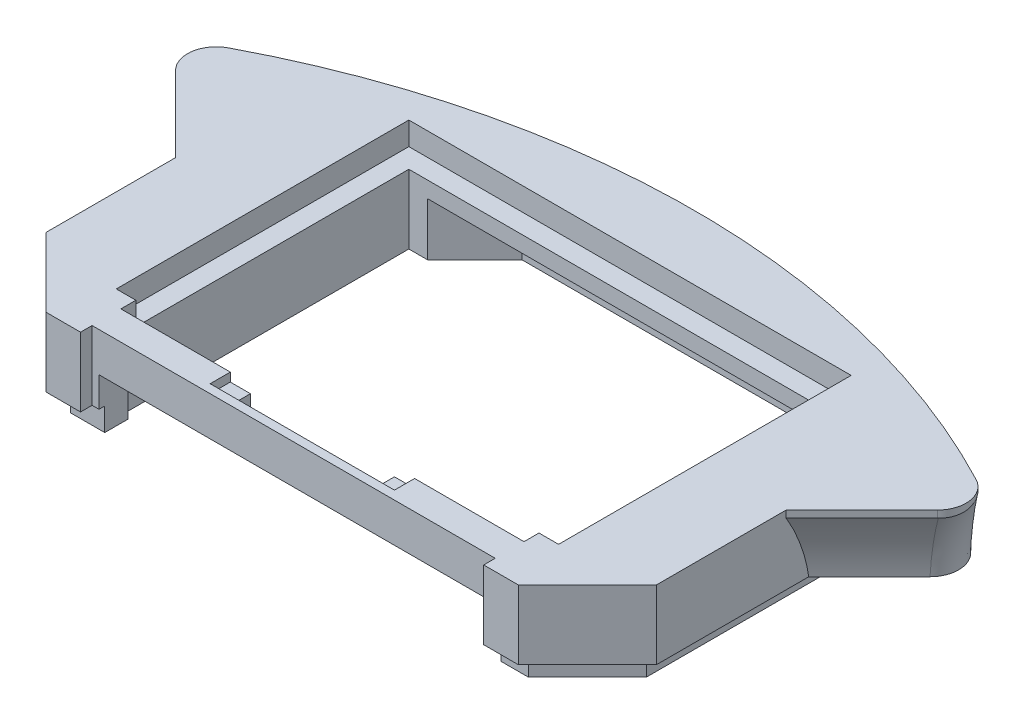
from build123d import *

# Parameters (mm, degrees)
BOSS_EXTRUDE1_DEPTH = 16
CUT_EXTRUDE1_DEPTH  = 9.2
CUT_EXTRUDE2_REACH  = 152.177
SKETCH3_W           = 70
SKETCH3_H           = 50
SKETCH7_OUTSIDE_W   = 133.782
SKETCH7_OUTSIDE_H   = 99.382
CUT_EXTRUDE5_DEPTH  = 4
BOSS_EXTRUDE3_START = -12
BOSS_EXTRUDE3_DEPTH = 12
CUT_EXTRUDE7_REACH  = 174.842
SKETCH9_R           = 38
CUT_EXTRUDE8_REACH  = 174.842
SKETCH10_R          = 38
FILLET1_R           = 5
SKETCH12_W          = 25
SKETCH12_H          = 3.5
CUT_EXTRUDE10_DEPTH = 4
SKETCH13_W          = 3.5
SKETCH13_H          = 3.5
CUT_EXTRUDE11_DEPTH = 1.5
CUT_EXTRUDE12_REACH = 157.926
SKETCH14_W          = 70
SKETCH14_H          = 2
CUT_EXTRUDE13_DEPTH = 4


with BuildPart() as part:
    # Sketch1 → Boss-Extrude1 (new body)
    with BuildSketch(Plane(origin=(0, 0, 0), x_dir=(1, 0, 0), z_dir=(0, 1, 0))):
        with BuildLine():
            Line((-53, 129.147822281), (-53, 80))
            Line((-53, 80), (-41, 68))
            Line((-41, 68), (41, 68))
            Line((41, 68), (53, 80))
            Line((53, 80), (53, 129.147822281))
            ThreePointArc((53, 129.147822281), (0, 139.6), (-53, 129.147822281))
        make_face()
    extrude(amount=BOSS_EXTRUDE1_DEPTH)

    # Sketch2 → Cut-Extrude1 (cut)
    with BuildSketch(Plane.XZ):
        Polygon((-33.8, -122.965685425), (-33.8, -62.4), (35, -62.4), (35, -122.965685425), (24.765685425, -133.2), (-23.565685425, -133.2), align=None)
    extrude(amount=-CUT_EXTRUDE1_DEPTH, mode=Mode.SUBTRACT)

    # Sketch3 → Cut-Extrude2 (cut, up to next)
    with BuildSketch(Plane(origin=(0, 16, 0), x_dir=(1, 0, 0), z_dir=(0, 1, 0)), mode=Mode.PRIVATE) as cut_extrude2_sk1:
        with Locations((0, 100)):
            Rectangle(SKETCH3_W, SKETCH3_H)
    cut_extrude2_tool1 = extrude(cut_extrude2_sk1.sketch, amount=-CUT_EXTRUDE2_REACH, mode=Mode.PRIVATE) & part.part
    add(cut_extrude2_tool1.solids().sort_by_distance((0, 16, -100))[0], mode=Mode.SUBTRACT)

    # Sketch7 outside → Cut-Extrude5 (cut)
    with BuildSketch(Plane.XZ):
        with Locations((0, -103.8)):
            Rectangle(SKETCH7_OUTSIDE_W, SKETCH7_OUTSIDE_H)
        with BuildLine():
            Line((-50, -81.242640687), (-50, -127.120258024))
            ThreePointArc((-50, -127.120258024), (0, -136.6), (50, -127.120258024))
            Line((50, -127.120258024), (50, -81.242640687))
            Line((50, -81.242640687), (39.757359313, -71))
            Line((39.757359313, -71), (35, -71))
            Line((35, -71), (-33.8, -71))
            Line((-33.8, -71), (-39.757359313, -71))
            Line((-39.757359313, -71), (-50, -81.242640687))
        make_face(mode=Mode.SUBTRACT)
    extrude(amount=-CUT_EXTRUDE5_DEPTH, mode=Mode.SUBTRACT)

    # Sketch8 → Boss-Extrude3 (add)
    with BuildSketch(Plane(origin=(0, 16, 0), x_dir=(1, 0, 0), z_dir=(0, 1, 0)).offset(BOSS_EXTRUDE3_START)):
        with BuildLine():
            Line((70.810563619, 120.308038302), (53, 102.497474683))
            Line((53, 102.497474683), (53, 129.147822281))
            ThreePointArc((53, 129.147822281), (62.062866201, 125.045434299), (70.810563619, 120.308038302))
        make_face()
    boss_extrude3 = extrude(amount=BOSS_EXTRUDE3_DEPTH)

    # Mirror1: Boss-Extrude3 across plane
    add(boss_extrude3.mirror(Plane(origin=(0, 0, 0), x_dir=(0, 0, 1), z_dir=(1, 0, 0))))

    # Cut-Extrude7: up to this plane
    cut_extrude7_end = Plane(origin=(53, 16, -80), z_dir=(-1, 0, 0))
    # Sketch9 → Cut-Extrude7 (cut, up to the surface)
    with BuildSketch(Plane(origin=(95.55930096, 0, -95.55930096), x_dir=(0, 1, 0), z_dir=(-0.7071067811865488, 0, 0.7071067811865464)), mode=Mode.PRIVATE) as cut_extrude7_sk1:
        Circle(SKETCH9_R)
    cut_extrude7_tool1 = split(extrude(cut_extrude7_sk1.sketch, amount=CUT_EXTRUDE7_REACH, mode=Mode.PRIVATE), bisect_by=cut_extrude7_end, keep=Keep.BOTH, mode=Mode.PRIVATE)
    add(cut_extrude7_tool1.solids().sort_by_distance((95.559301, 0, -95.559301))[0], mode=Mode.SUBTRACT)

    # Cut-Extrude8: up to this plane
    cut_extrude8_end = Plane(origin=(-53, 16, -129.147822281), z_dir=(1, 0, 0))
    # Sketch10 → Cut-Extrude8 (cut, up to the surface)
    with BuildSketch(Plane(origin=(-95.55930096, 0, -95.55930096), x_dir=(0, 1, 0), z_dir=(0.7071067811865488, 0, 0.7071067811865464)), mode=Mode.PRIVATE) as cut_extrude8_sk1:
        Circle(SKETCH10_R)
    cut_extrude8_tool1 = split(extrude(cut_extrude8_sk1.sketch, amount=CUT_EXTRUDE8_REACH, mode=Mode.PRIVATE), bisect_by=cut_extrude8_end, keep=Keep.BOTH, mode=Mode.PRIVATE)
    add(cut_extrude8_tool1.solids().sort_by_distance((-95.559301, 0, -95.559301))[0], mode=Mode.SUBTRACT)

    # Fillet1
    fillet1_edges = [part.edges().sort_by_distance(p)[0] for p in [
        (70.810563619, 15.399324293, -120.308038302),
        (69.207065384, 9.508661419, -121.237544106),
        (-70.810563619, 15.399324293, -120.308038302),
        (-69.207065384, 9.508661419, -121.237544106),
    ]]
    fillet(fillet1_edges, radius=FILLET1_R)

    # Sketch12 → Cut-Extrude10 (cut)
    with BuildSketch(Plane(origin=(0, 16, 0), x_dir=(1, 0, 0), z_dir=(0, 1, 0))):
        with Locations((0, 73.25)):
            Rectangle(SKETCH12_W, SKETCH12_H)
    extrude(amount=-CUT_EXTRUDE10_DEPTH, mode=Mode.SUBTRACT)

    # Sketch13 → Cut-Extrude11 (cut)
    with BuildSketch(Plane(origin=(0, 16, 0), x_dir=(1, 0, 0), z_dir=(0, 1, 0))):
        with Locations((-14.25, 73.25)):
            Rectangle(SKETCH13_W, SKETCH13_H)
        with Locations((14.25, 73.25)):
            Rectangle(SKETCH13_W, SKETCH13_H)
    extrude(amount=-CUT_EXTRUDE11_DEPTH, mode=Mode.SUBTRACT)

    # Sketch14 → Cut-Extrude12 (cut, up to next)
    with BuildSketch(Plane(origin=(0, 16, 0), x_dir=(1, 0, 0), z_dir=(0, 1, 0)), mode=Mode.PRIVATE) as cut_extrude12_sk1:
        with Locations((0, 69)):
            Rectangle(SKETCH14_W, SKETCH14_H)
    cut_extrude12_tool1 = extrude(cut_extrude12_sk1.sketch, amount=-CUT_EXTRUDE12_REACH, mode=Mode.PRIVATE) & part.part
    add(cut_extrude12_tool1.solids().sort_by_distance((0, 16, -69))[0], mode=Mode.SUBTRACT)

    # Sketch15 → Cut-Extrude13 (cut)
    with BuildSketch(Plane(origin=(0, 16, 0), x_dir=(1, 0, 0), z_dir=(0, 1, 0))):
        Polygon((-35, 77.6), (-35, 125), (35, 125), (35, 77.6), (38.4, 77.6), (38.4, 128.4), (-38.4, 128.4), (-38.4, 77.6), align=None)
    extrude(amount=-CUT_EXTRUDE13_DEPTH, mode=Mode.SUBTRACT)


solid = part.part
